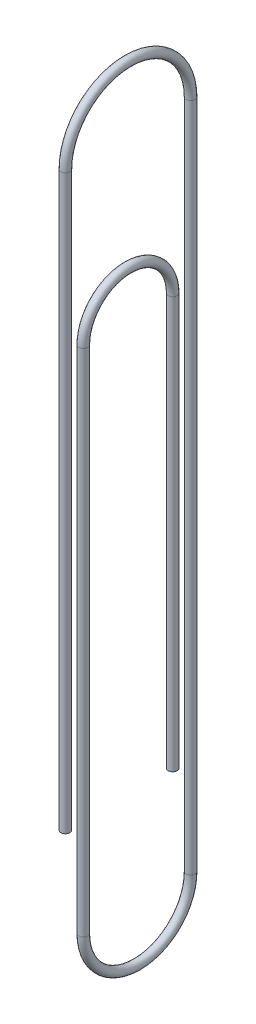
from build123d import *

# Parameters (mm, degrees)
SKETCH2_R = 0.25


with BuildPart() as part:
    # Sweep1: sweep along a path in Sketch1
    with BuildLine(Plane.YZ) as sweep1_path:
        Line((0, 0), (32, 0))
        ThreePointArc((32, 0), (35.5, -3.5), (32, -7))
        Line((32, -7), (-5.5, -7))
        ThreePointArc((-5.5, -7), (-8.5, -4), (-5.5, -1))
        Line((-5.5, -1), (23, -1))
        ThreePointArc((23, -1), (25.5, -3.5), (23, -6))
        Line((23, -6), (0, -6))
    # Sketch2 → Sweep1 (sweep)
    with BuildSketch(Plane(origin=(0, 0, 0), x_dir=(-1, 0, 0), z_dir=(0, 1, 0))):
        Circle(SKETCH2_R)
    sweep(path=sweep1_path.line)


solid = part.part
